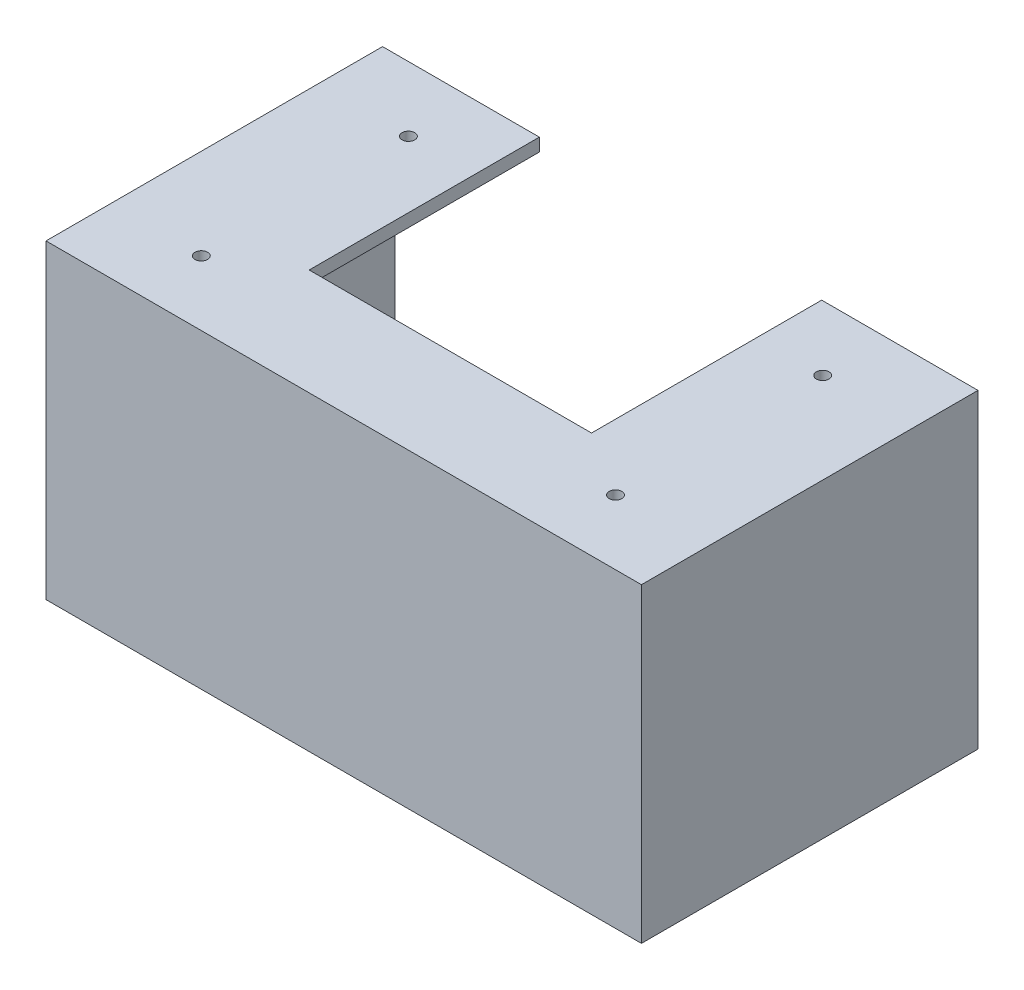
from build123d import *

# Parameters (mm, degrees)
SKETCH1_W           = 146.05
SKETCH1_H           = 76.2
SKETCH1_W_2         = 139.7
SKETCH1_H_2         = 69.85
BOSS_EXTRUDE1_DEPTH = 76.2
SKETCH2_W           = 146.05
SKETCH2_H           = 76.2
BOSS_EXTRUDE2_DEPTH = 6.35
SKETCH3_R           = 1.55
CUT_EXTRUDE1_DEPTH  = 6.35
SKETCH4_W           = 69.251410207
SKETCH4_H           = 56.45274813
CUT_EXTRUDE2_DEPTH  = 25.4


with BuildPart() as part:
    # Sketch1 → Boss-Extrude1 (new body)
    with BuildSketch(Plane.XY):
        with Locations((70.004169971, -34.925)):
            Rectangle(SKETCH1_W, SKETCH1_H)
        with Locations((69.85, -34.925)):
            Rectangle(SKETCH1_W_2, SKETCH1_H_2, mode=Mode.SUBTRACT)
    extrude(amount=BOSS_EXTRUDE1_DEPTH)

    # Sketch2 → Boss-Extrude2 (add)
    with BuildSketch(Plane.XY.offset(76.2)):
        with Locations((70.004169971, -34.925)):
            Rectangle(SKETCH2_W, SKETCH2_H)
    extrude(amount=BOSS_EXTRUDE2_DEPTH)

    # Sketch3 → Cut-Extrude1 (cut)
    with BuildSketch(Plane(origin=(0, 3.175, 0), x_dir=(1, 0, 0), z_dir=(0, 1, 0))):
        with Locations(Location((19.204169971, -15.875, 0), (0, 0, 270))):
            Circle(SKETCH3_R)
        with Locations(Location((120.804169971, -15.875, 0), (0, 0, 270))):
            Circle(SKETCH3_R)
        with Locations(Location((120.804169971, -66.675, 0), (0, 0, 270))):
            Circle(SKETCH3_R)
        with Locations(Location((19.204169971, -66.675, 0), (0, 0, 270))):
            Circle(SKETCH3_R)
    extrude(amount=-CUT_EXTRUDE1_DEPTH, mode=Mode.SUBTRACT)

    # Sketch4 → Cut-Extrude2 (cut)
    with BuildSketch(Plane(origin=(0, 3.175, 0), x_dir=(1, 0, 0), z_dir=(0, 1, 0))):
        with Locations((70.062674023, -28.226374065)):
            Rectangle(SKETCH4_W, SKETCH4_H)
    extrude(amount=-CUT_EXTRUDE2_DEPTH, mode=Mode.SUBTRACT)


solid = part.part
